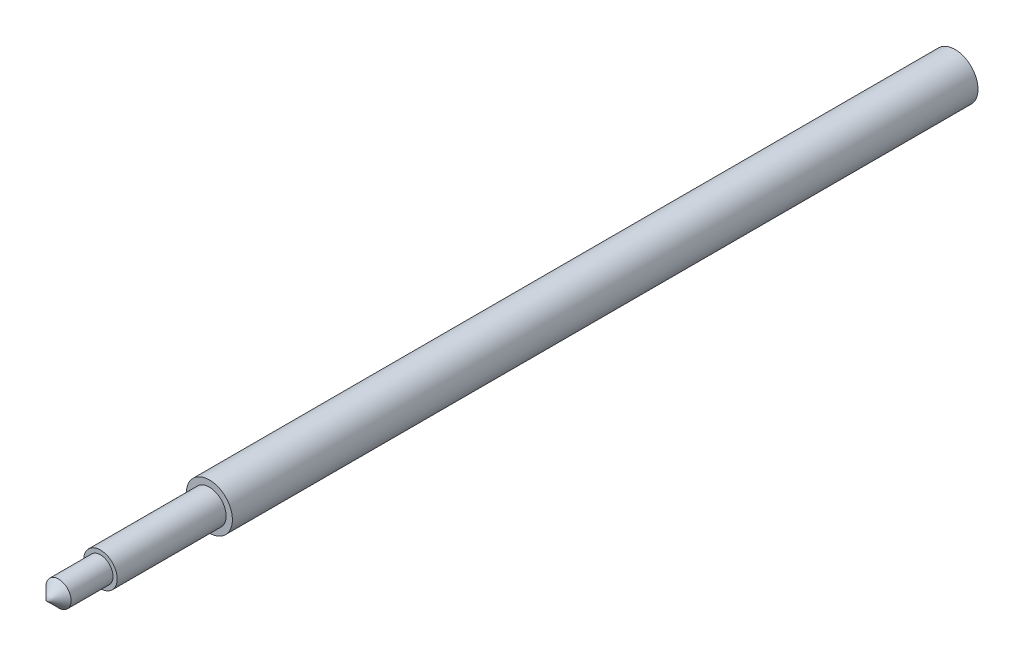
from build123d import *

# Parameters (mm, degrees)
SKETCH_1_R      = 2.75
EXTRUDE_1_DEPTH = 89
SKETCH_2_R      = 2
EXTRUDE_2_DEPTH = 13
SKETCH_3_R      = 1.5
EXTRUDE_3_DEPTH = 5


with BuildPart() as part:
    # 草图1 → 凸台-拉伸1 (new body)
    with BuildSketch(Plane.XY):
        Circle(SKETCH_1_R)
    extrude(amount=EXTRUDE_1_DEPTH)

    # 草图2 → 凸台-拉伸2 (add)
    with BuildSketch(Plane.XY.offset(89)):
        with Locations(Location((0, 0, 0), (0, 0, 180))):
            Circle(SKETCH_2_R)
    extrude(amount=EXTRUDE_2_DEPTH)

    # 草图3 → 凸台-拉伸3 (add)
    with BuildSketch(Plane.XY.offset(102)):
        Circle(SKETCH_3_R)
    extrude(amount=EXTRUDE_3_DEPTH)

    # 草图4 → 旋转1 (revolve)
    with BuildSketch(Plane(origin=(0, 0, 0), x_dir=(1, 0, 0), z_dir=(0, 1, 0))):
        Polygon((0, -107), (0, -108.500036411), (-1.5, -107), align=None)
    revolve(axis=Axis((0, 0, 107), (0, 0, 1)))


solid = part.part
